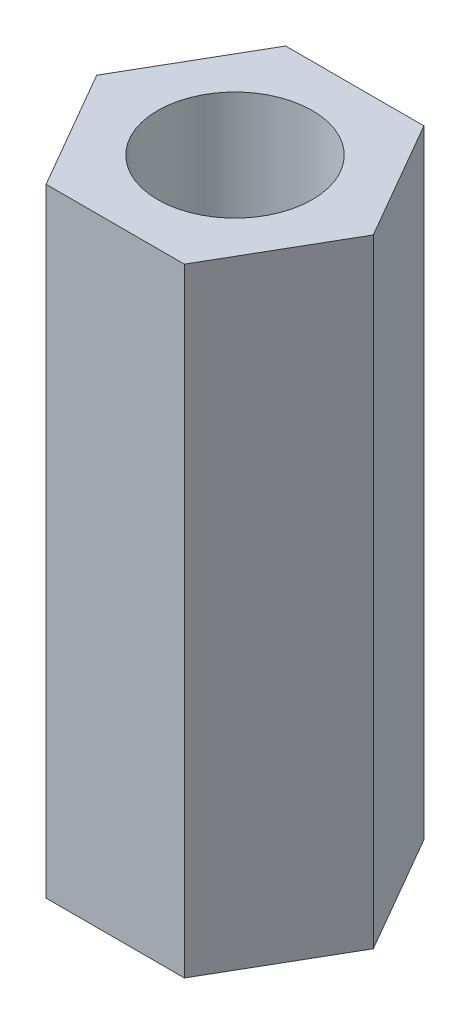
from build123d import *

# Parameters (mm, degrees)
SKETCH_1_R      = 1.5
EXTRUDE_1_DEPTH = 12


with BuildPart() as part:
    # 草图1 → 凸台-拉伸1 (new body)
    with BuildSketch(Plane(origin=(0, 0, 0), x_dir=(1, 0, 0), z_dir=(0, 1, 0))):
        Polygon((2.684678752, 0), (1.342339376, 2.325), (-1.342339376, 2.325), (-2.684678752, 0), (-1.342339376, -2.325), (1.342339376, -2.325), align=None)
        with Locations(Location((0, 0, 0), (0, 0, 270))):
            Circle(SKETCH_1_R, mode=Mode.SUBTRACT)
    extrude(amount=EXTRUDE_1_DEPTH)


solid = part.part
